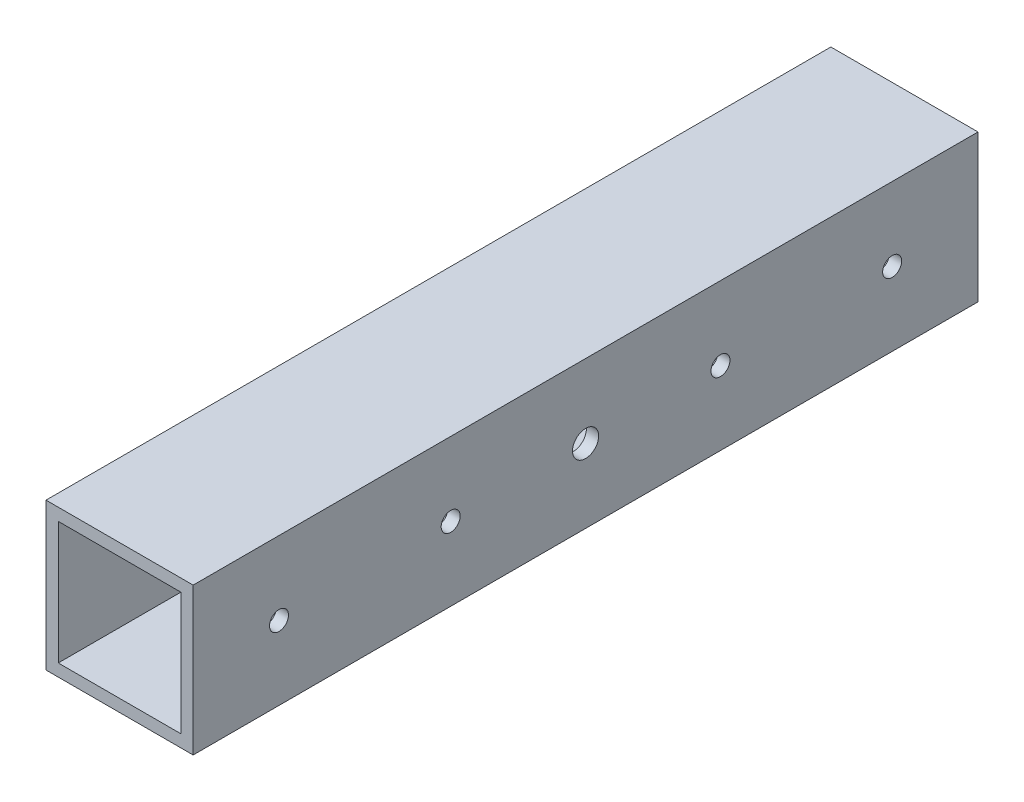
from build123d import *

# Parameters (mm, degrees)
SKETCH1_W                    = 38.1
SKETCH1_H                    = 38.1
SKETCH1_W_2                  = 31.75
SKETCH1_H_2                  = 31.75
BOSS_EXTRUDE1_DEPTH          = 203.2
F_10_0_1935_DIAMETER_HOLE1_D = 4.9149
F_1_4_CLEARANCE_HOLE1_D      = 6.7564


with BuildPart() as part:
    # Sketch1 → Boss-Extrude1 (new body)
    with BuildSketch(Plane.XY):
        Rectangle(SKETCH1_W, SKETCH1_H)
        Rectangle(SKETCH1_W_2, SKETCH1_H_2, mode=Mode.SUBTRACT)
    extrude(amount=BOSS_EXTRUDE1_DEPTH)

    # #10 (0.1935) Diameter Hole1 (through all)
    with Locations(Plane.ZY.offset(19.05)):
        with Locations((22.225, 0), (66.675, 0), (136.525, 0), (180.975, 0)):
            Hole(F_10_0_1935_DIAMETER_HOLE1_D / 2)

    # 1/4 Clearance Hole1 (through all)
    with Locations(Plane(origin=(19.05, 0, 0), x_dir=(0, 0, -1), z_dir=(1, 0, 0))):
        with Locations((-101.6, 0)):
            Hole(F_1_4_CLEARANCE_HOLE1_D / 2)


solid = part.part
